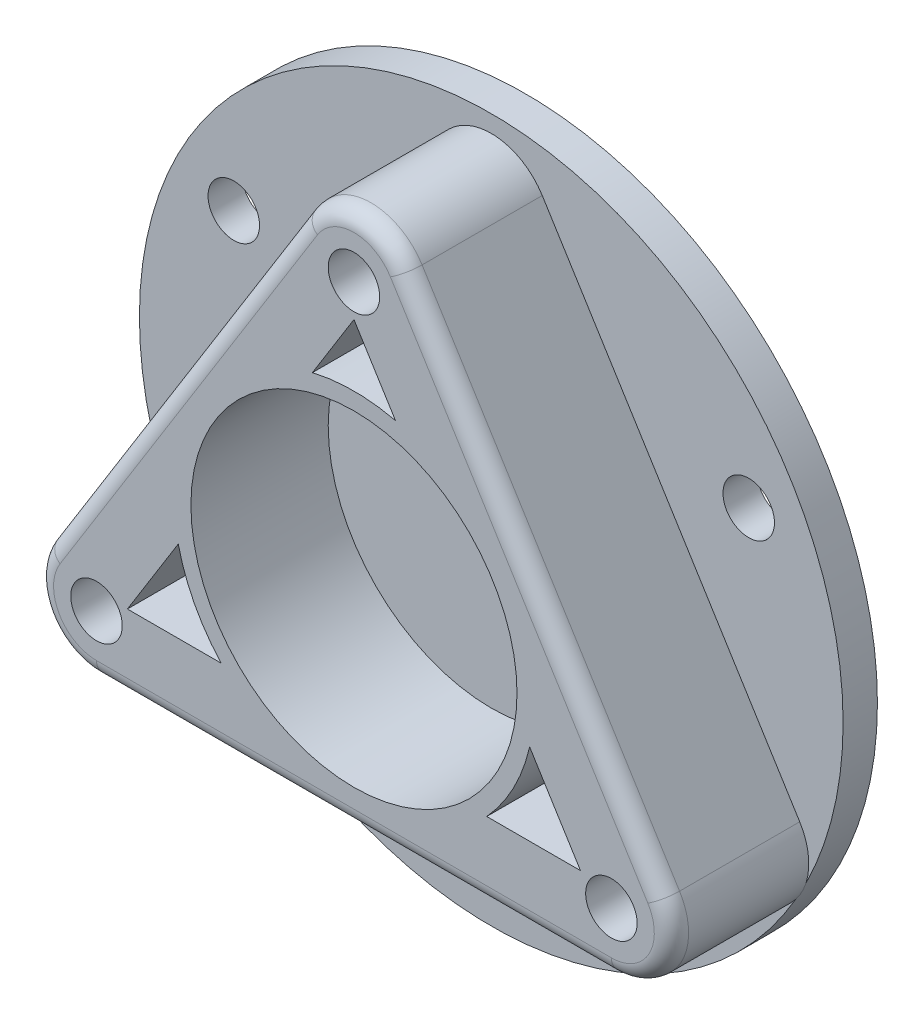
from build123d import *

# Parameters (mm, degrees)
CROQUIS1_R              = 20.5
CROQUIS1_R_2            = 1.5
SALIENTE_EXTRUIR1_DEPTH = 2
CROQUIS2_R              = 11.5
CROQUIS2_R_2            = 9.5
SALIENTE_EXTRUIR2_DEPTH = 8
CROQUIS3_R              = 1.5
CROQUIS3_R_2            = 9.5
SALIENTE_EXTRUIR4_DEPTH = 8
REDONDEO1_R             = 1
CORTAR_EXTRUIR1_DEPTH   = 8


with BuildPart() as part:
    # Croquis1 → Saliente-Extruir1 (new body)
    with BuildSketch(Plane.XY):
        Circle(CROQUIS1_R)
        with Locations((15, 8.1)):
            Circle(CROQUIS1_R_2, mode=Mode.SUBTRACT)
        with Locations((0, -16)):
            Circle(CROQUIS1_R_2, mode=Mode.SUBTRACT)
        with Locations(Location((-15, 8.1, 0), (0, 0, 180))):
            Circle(CROQUIS1_R_2, mode=Mode.SUBTRACT)
    extrude(amount=SALIENTE_EXTRUIR1_DEPTH)

    # Croquis2 → Saliente-Extruir2 (add)
    with BuildSketch(Plane.XY.offset(2)):
        Circle(CROQUIS2_R)
        Circle(CROQUIS2_R_2, mode=Mode.SUBTRACT)
    extrude(amount=SALIENTE_EXTRUIR2_DEPTH)

    # Croquis3 → Saliente-Extruir4 (add)
    with BuildSketch(Plane.XY.offset(2)):
        with BuildLine():
            Line((-15, -11.6), (15, -11.6))
            ThreePointArc((15, -11.6), (18.059663437, -9.799546895), (17.971452283, -6.250548371))
            Line((17.971452283, -6.250548371), (2.971452283, 17.849451629))
            ThreePointArc((2.971452283, 17.849451629), (0, 19.5), (-2.971452283, 17.849451629))
            Line((-2.971452283, 17.849451629), (-17.971452283, -6.250548371))
            ThreePointArc((-17.971452283, -6.250548371), (-18.059663437, -9.799546895), (-15, -11.6))
        make_face()
        with Locations((15, -8.1)):
            Circle(CROQUIS3_R, mode=Mode.SUBTRACT)
        with Locations((-15, -8.1)):
            Circle(CROQUIS3_R, mode=Mode.SUBTRACT)
        with Locations((0, 16)):
            Circle(CROQUIS3_R, mode=Mode.SUBTRACT)
        Circle(CROQUIS3_R_2, mode=Mode.SUBTRACT)
    extrude(amount=SALIENTE_EXTRUIR4_DEPTH)

    # Redondeo1
    redondeo1_edges = [part.edges().sort_by_distance(p)[0] for p in [
        (-10.471452283, 5.799451629, 10),
        (-18.059663437, -9.799546895, 10),
        (0, -11.6, 10),
        (18.059663437, -9.799546895, 10),
        (10.471452283, 5.799451629, 10),
        (0, 19.5, 10),
    ]]
    fillet(redondeo1_edges, radius=REDONDEO1_R)

    # Croquis4 → Cortar-Extruir1 (cut)
    with BuildSketch(Plane.XY.offset(10)):
        with BuildLine():
            Line((-10.236239063, -2.338676942), (-13.199718145, -7.1))
            Line((-13.199718145, -7.1), (-7.735631842, -7.1))
            ThreePointArc((-7.735631842, -7.1), (-9.295944561, -4.882152673), (-10.236239063, -2.338676942))
        make_face()
        with BuildLine():
            Line((2.421529631, 10.216956212), (0, 14.107547153))
            Line((0, 14.107547153), (-2.421529631, 10.216956212))
            ThreePointArc((-2.421529631, 10.216956212), (0, 10.5), (2.421529631, 10.216956212))
        make_face()
        with BuildLine():
            Line((7.735631842, -7.1), (13.199718145, -7.1))
            Line((13.199718145, -7.1), (10.236239063, -2.338676942))
            ThreePointArc((10.236239063, -2.338676942), (9.295944561, -4.882152673), (7.735631842, -7.1))
        make_face()
    extrude(amount=-CORTAR_EXTRUIR1_DEPTH, mode=Mode.SUBTRACT)


solid = part.part
